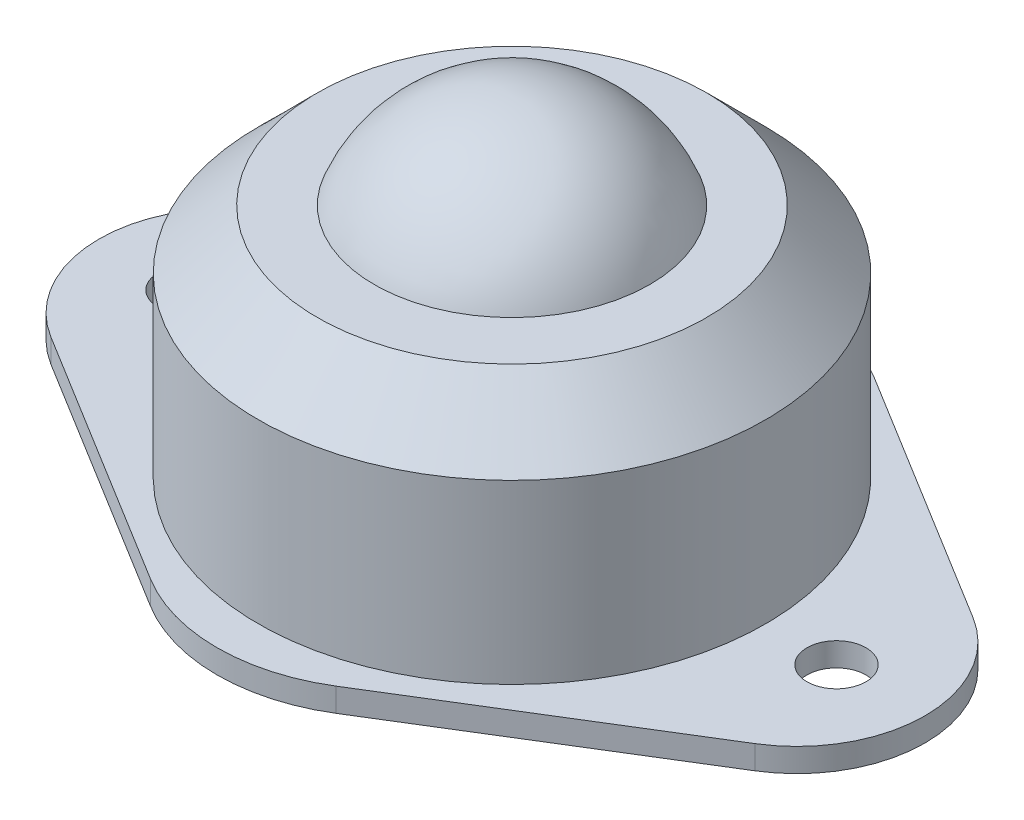
from build123d import *

# Parameters (mm, degrees)
SKETCH_2_R      = 2.5
EXTRUDE_1_DEPTH = 2


with BuildPart() as part:
    # 草图1 → 旋转2 (revolve)
    with BuildSketch(Plane.XY, mode=Mode.PRIVATE) as revolve_2_sk:
        with BuildLine():
            ThreePointArc((0, 12.5), (-7.079662177, 10.301863107), (-11.669393693, 4.480541354))
            Line((-11.669393693, 4.480541354), (-16.5, 4.480541354))
            Line((-16.5, 4.480541354), (-21.5, -0.519458646))
            Line((-21.5, -0.519458646), (-21.5, -15.5))
            Line((-21.5, -15.5), (0, -15.5))
            Line((0, -15.5), (0, 12.5))
        make_face()
    revolve(revolve_2_sk.sketch.rotate(Axis((0, 0, 0), (0, 1, 0)), 270), axis=Axis((0, 0, 0), (0, 1, 0)))

    # 草图2 → 凸台-拉伸1 (add)
    with BuildSketch(Plane.XZ.offset(15.5)):
        with BuildLine():
            Line((-29.841345501, 9.236236767), (-7.866752906, 22.771616919))
            ThreePointArc((-7.866752906, 22.771616919), (0, 25), (7.866752906, 22.771616919))
            Line((7.866752906, 22.771616919), (29.841345501, 9.236236767))
            ThreePointArc((29.841345501, 9.236236767), (35, 0), (29.841345501, -9.236236767))
            Line((29.841345501, -9.236236767), (7.866752906, -22.771616919))
            ThreePointArc((7.866752906, -22.771616919), (0, -25), (-7.866752906, -22.771616919))
            Line((-7.866752906, -22.771616919), (-29.841345501, -9.236236767))
            ThreePointArc((-29.841345501, -9.236236767), (-35, 0), (-29.841345501, 9.236236767))
        make_face()
        with Locations(Location((-27.5, 0, 0), (0, 0, 270))):
            Circle(SKETCH_2_R, mode=Mode.SUBTRACT)
        with Locations(Location((27.5, 0, 0), (0, 0, 90))):
            Circle(SKETCH_2_R, mode=Mode.SUBTRACT)
    extrude(amount=EXTRUDE_1_DEPTH)


solid = part.part
